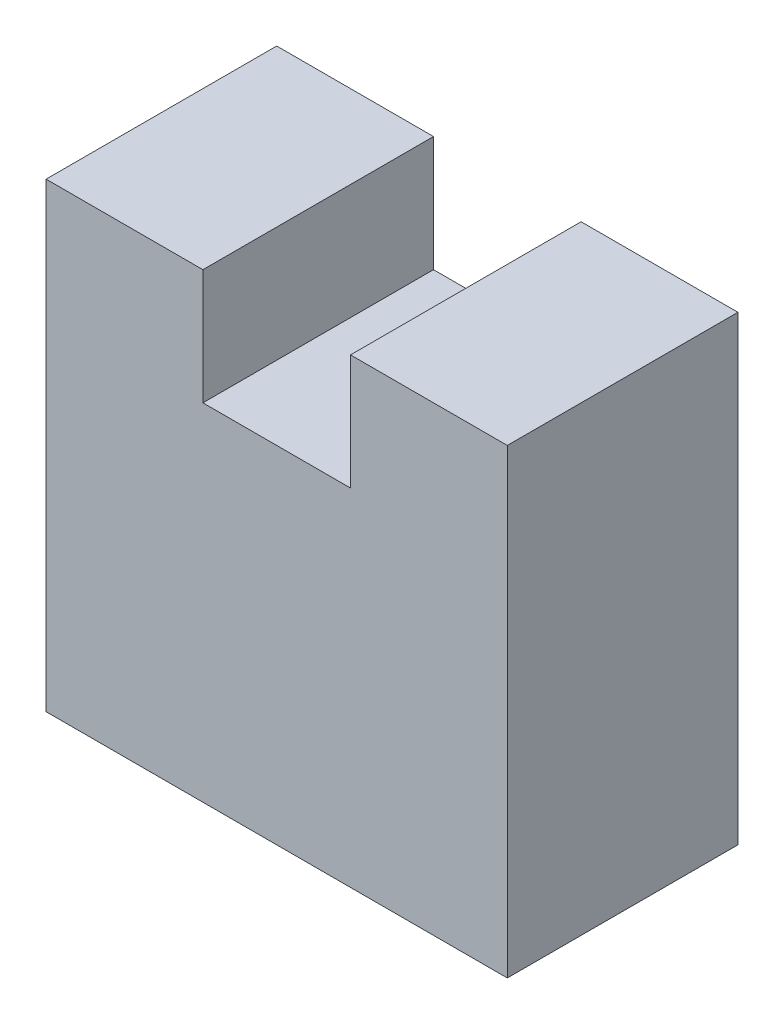
from build123d import *

# Parameters (mm, degrees)
SKETCH_1_W          = 20
SKETCH_1_H          = 20
EXTRUDE_1_DEPTH     = 10
CUT_EXTRUDE_1_DEPTH = 10


with BuildPart() as part:
    # 草图1 → 凸台-拉伸1 (new body)
    with BuildSketch(Plane.XY):
        Rectangle(SKETCH_1_W, SKETCH_1_H)
    extrude(amount=EXTRUDE_1_DEPTH)

    # 草图2 → 切除-拉伸1 (cut)
    with BuildSketch(Plane.XY.offset(10)):
        Polygon((0, 10), (3.2, 10), (3.2, 5), (-3.2, 5), (-3.2, 10), align=None)
    extrude(amount=-CUT_EXTRUDE_1_DEPTH, mode=Mode.SUBTRACT)


solid = part.part
